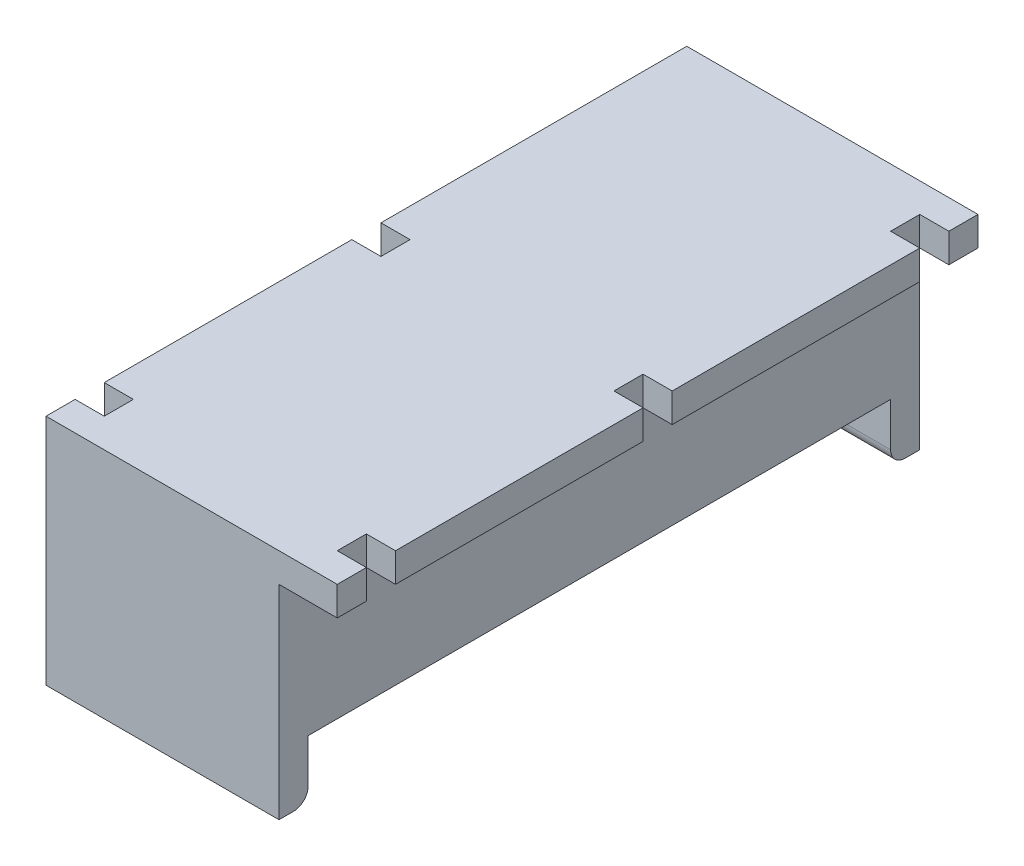
from build123d import *

# Parameters (mm, degrees)
SKETCH2_W           = 50
SKETCH2_H           = 110
SKETCH2_W_2         = 40
SKETCH2_H_2         = 100
BOSS_EXTRUDE1_DEPTH = 30
SKETCH3_W           = 6
SKETCH3_H           = 6
CUT_EXTRUDE1_DEPTH  = 5
SKETCH2_4_W         = 40
SKETCH2_4_H         = 100
BOSS_EXTRUDE2_DEPTH = 5
CUT_EXTRUDE2_DEPTH  = 25
BOSS_EXTRUDE3_DEPTH = 25
SKETCH10_W          = 40
SKETCH10_H          = 5
BOSS_EXTRUDE4_DEPTH = 35
SKETCH11_W          = 5
SKETCH11_H          = 5
CUT_EXTRUDE5_DEPTH  = 6
SKETCH11_4_W        = 5
SKETCH11_4_H        = 5
CUT_EXTRUDE6_DEPTH  = 4.99
FILLET1_R           = 2.5


with BuildPart() as part:
    # Sketch2 → Boss-Extrude1 (new body)
    with BuildSketch(Plane(origin=(0, 0, 0), x_dir=(1, 0, 0), z_dir=(0, 1, 0))):
        with Locations((2.5, 5)):
            Rectangle(SKETCH2_W, SKETCH2_H)
        with Locations((2.5, 5)):
            Rectangle(SKETCH2_W_2, SKETCH2_H_2, mode=Mode.SUBTRACT)
    extrude(amount=-BOSS_EXTRUDE1_DEPTH)

    # Sketch3 → Cut-Extrude1 (cut)
    with BuildSketch(Plane.ZY.offset(22.5)):
        with Locations((-35, -25)):
            Rectangle(SKETCH3_W, SKETCH3_H)
    extrude(amount=-CUT_EXTRUDE1_DEPTH, mode=Mode.SUBTRACT)

    # Sketch2<4> → Boss-Extrude2 (add)
    with BuildSketch(Plane(origin=(0, 0, 0), x_dir=(1, 0, 0), z_dir=(0, 1, 0))):
        with Locations((2.5, 5)):
            Rectangle(SKETCH2_4_W, SKETCH2_4_H)
    extrude(amount=-BOSS_EXTRUDE2_DEPTH)

    # Sketch5 → Cut-Extrude2 (cut)
    with BuildSketch(Plane.XZ.offset(30)):
        Polygon((27.5, 50), (-22.5, 50), (-22.5, 45), (-17.5, 45), (17.5, 45), (22.5, 45), (22.5, -55), (17.5, -55), (-17.5, -55), (-22.5, -55), (-22.5, -60), (27.5, -60), align=None)
    extrude(amount=-CUT_EXTRUDE2_DEPTH, mode=Mode.SUBTRACT)

    # Sketch5<3> → Boss-Extrude3 (add)
    with BuildSketch(Plane.XZ.offset(30)):
        Polygon((17.5, 45), (-17.5, 45), (-17.5, 40), (12.5, 40), (12.5, -50), (-17.5, -50), (-17.5, -55), (17.5, -55), align=None)
    extrude(amount=-BOSS_EXTRUDE3_DEPTH)

    # Sketch10 → Boss-Extrude4 (add)
    with BuildSketch(Plane.XZ.offset(5)):
        with Locations((-2.5, 47.5)):
            Rectangle(SKETCH10_W, SKETCH10_H)
        with Locations((-2.5, -57.5)):
            Rectangle(SKETCH10_W, SKETCH10_H)
    extrude(amount=BOSS_EXTRUDE4_DEPTH)

    # Sketch11 → Cut-Extrude5 (cut)
    with BuildSketch(Plane(origin=(0, 0, 0), x_dir=(1, 0, 0), z_dir=(0, 1, 0))):
        with Locations((25, 52.5)):
            Rectangle(SKETCH11_W, SKETCH11_H)
        with Locations((25, 5)):
            Rectangle(SKETCH11_W, SKETCH11_H)
        with Locations((25, -42.5)):
            Rectangle(SKETCH11_W, SKETCH11_H)
    extrude(amount=-CUT_EXTRUDE5_DEPTH, mode=Mode.SUBTRACT)

    # Sketch11<4> → Cut-Extrude6 (cut)
    with BuildSketch(Plane(origin=(0, 0, 0), x_dir=(1, 0, 0), z_dir=(0, 1, 0))):
        with Locations((-20, 5)):
            Rectangle(SKETCH11_4_W, SKETCH11_4_H)
        with Locations((-20, -42.5)):
            Rectangle(SKETCH11_4_W, SKETCH11_4_H)
    extrude(amount=-CUT_EXTRUDE6_DEPTH, mode=Mode.SUBTRACT)

    # Fillet1
    fillet1_edges = [part.edges().sort_by_distance(p)[0] for p in [
        (-2.5, -40, -55),
        (-2.5, -40, 45),
    ]]
    fillet(fillet1_edges, radius=FILLET1_R)


solid = part.part
